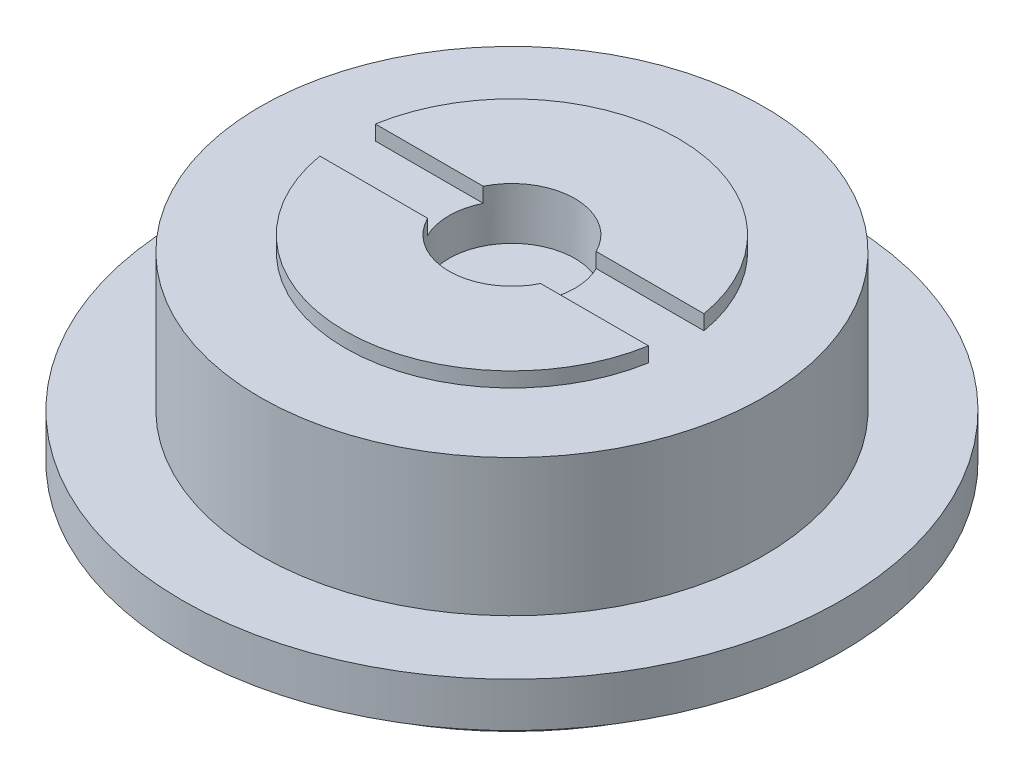
from build123d import *

# Parameters (mm, degrees)
BASES_R               = 8.9
BASE_DEPTH            = 1.2
O_RINGCAPTURES_R      = 6.8
O_RINGCAPTURE_DEPTH   = 3.7
SEALINGFACES_R        = 4.5
SEALINGFACE_DEPTH     = 0.4
SLOTCUTS_W            = 9
SLOTCUTS_H            = 1.5
SLOTCUT_DEPTH         = 0.4
BOTTOMBASES_R         = 7.8
BOTTOMBASE_DEPTH      = 0.8
TOPBORES_R            = 1.7
TOPBORE_DEPTH         = 1.4
BOTTOMBORES_R         = 5.5
BOTTOMBORE_DEPTH      = 4.4
CENTRALCYLINDERS_R    = 2.5
CENTRALCYLINDER_DEPTH = 2.6
CYLINDERBORES_R       = 1.5
CYLINDERBORE_DEPTH    = 0.6
RIB_REACH             = 15.333
RIBCP_COUNT           = 8
RIBCUTS_W             = 1.25
RIBCUTS_H             = 3.3
RIBCUT_DEPTH          = 0.2
RIBCUTCP_COUNT        = 4


with BuildPart() as part:
    # BaseS → Base (new body)
    with BuildSketch(Plane(origin=(0, 0, 0), x_dir=(1, 0, 0), z_dir=(0, 1, 0))):
        with Locations(Location((0, 0, 0), (0, 0, 270))):
            Circle(BASES_R)
    extrude(amount=-BASE_DEPTH)

    # O-RingCaptureS → O-RingCapture (add)
    with BuildSketch(Plane(origin=(0, 0, 0), x_dir=(1, 0, 0), z_dir=(0, 1, 0))):
        with Locations(Location((0, 0, 0), (0, 0, 270))):
            Circle(O_RINGCAPTURES_R)
    extrude(amount=O_RINGCAPTURE_DEPTH)

    # SealingFaceS → SealingFace (add)
    with BuildSketch(Plane(origin=(0, 3.7, 0), x_dir=(1, 0, 0), z_dir=(0, 1, 0))):
        with Locations(Location((0, 0, 0), (0, 0, 270))):
            Circle(SEALINGFACES_R)
    extrude(amount=SEALINGFACE_DEPTH)

    # SlotCutS → SlotCut (cut)
    with BuildSketch(Plane(origin=(0, 4.1, 0), x_dir=(1, 0, 0), z_dir=(0, 1, 0))):
        Rectangle(SLOTCUTS_W, SLOTCUTS_H)
    extrude(amount=-SLOTCUT_DEPTH, mode=Mode.SUBTRACT)

    # BottomBaseS → BottomBase (add)
    with BuildSketch(Plane.XZ.offset(1.2)):
        with Locations(Location((0, 0, 0), (0, 0, 270))):
            Circle(BOTTOMBASES_R)
    extrude(amount=BOTTOMBASE_DEPTH)

    # TopBoreS → TopBore (cut)
    with BuildSketch(Plane(origin=(0, 4.1, 0), x_dir=(1, 0, 0), z_dir=(0, 1, 0))):
        with Locations(Location((0, 0, 0), (0, 0, 270))):
            Circle(TOPBORES_R)
    extrude(amount=-TOPBORE_DEPTH, mode=Mode.SUBTRACT)

    # BottomBoreS → BottomBore (cut)
    with BuildSketch(Plane.XZ.offset(2)):
        with Locations(Location((0, 0, 0), (0, 0, 270))):
            Circle(BOTTOMBORES_R)
    extrude(amount=-BOTTOMBORE_DEPTH, mode=Mode.SUBTRACT)

    # CentralCylinderS → CentralCylinder (add)
    with BuildSketch(Plane(origin=(0, 2.4, 0), x_dir=(-1, 0, 0), z_dir=(0, -1, 0))):
        with Locations(Location((0, 0, 0), (0, 0, 90))):
            Circle(CENTRALCYLINDERS_R)
    extrude(amount=CENTRALCYLINDER_DEPTH)

    # CylinderBoreS → CylinderBore (cut)
    with BuildSketch(Plane(origin=(0, -0.2, 0), x_dir=(-1, 0, 0), z_dir=(0, -1, 0))):
        with Locations(Location((0, 0, 0), (0, 0, 90))):
            Circle(CYLINDERBORES_R)
    extrude(amount=-CYLINDERBORE_DEPTH, mode=Mode.SUBTRACT)

    # Rib: up to this face of the body (flat: up to its plane)
    rib_end = Plane(part.part.faces().sort_by_distance((0, -2, 7.579382684))[0])
    # RibS → Rib (add, up to the picked face)
    with BuildSketch(Plane(origin=(0, 2.4, 0), x_dir=(-1, 0, 0), z_dir=(0, -1, 0)), mode=Mode.PRIVATE) as rib_sk1:
        with BuildLine():
            Line((0.625, -5.464373249), (0.625, -2.420614591))
            ThreePointArc((0.625, -2.420614591), (0, -2.5), (-0.625, -2.420614591))
            Line((-0.625, -2.420614591), (-0.625, -5.464373249))
            ThreePointArc((-0.625, -5.464373249), (0, -5.5), (0.625, -5.464373249))
        make_face()
    rib_tool1 = split(extrude(rib_sk1.sketch, amount=RIB_REACH, mode=Mode.PRIVATE), bisect_by=rib_end, keep=Keep.BOTH, mode=Mode.PRIVATE)
    rib = rib_tool1.solids().sort_by(Axis((0, 2.4, 3.98085), (0, -1, 0)))[0]
    add(rib)

    # RibCP: Rib ×8 about axis
    ribcp_axis = Axis((0, 0, 0), (0, 1, 0))
    for i in range(1, RIBCP_COUNT):
        add(rib.rotate(ribcp_axis, i * 360 / RIBCP_COUNT))

    # RibCutS → RibCut (cut)
    with BuildSketch(Plane.XZ.offset(2)):
        with Locations((0, 6.15)):
            Rectangle(RIBCUTS_W, RIBCUTS_H)
    ribcut = extrude(amount=-RIBCUT_DEPTH, mode=Mode.SUBTRACT)

    # RibCutCP: RibCut ×4 about axis
    ribcutcp_axis = Axis((0, 0, 0), (0, 1, 0))
    for i in range(1, RIBCUTCP_COUNT):
        add(ribcut.rotate(ribcutcp_axis, i * 360 / RIBCUTCP_COUNT), mode=Mode.SUBTRACT)


solid = part.part
